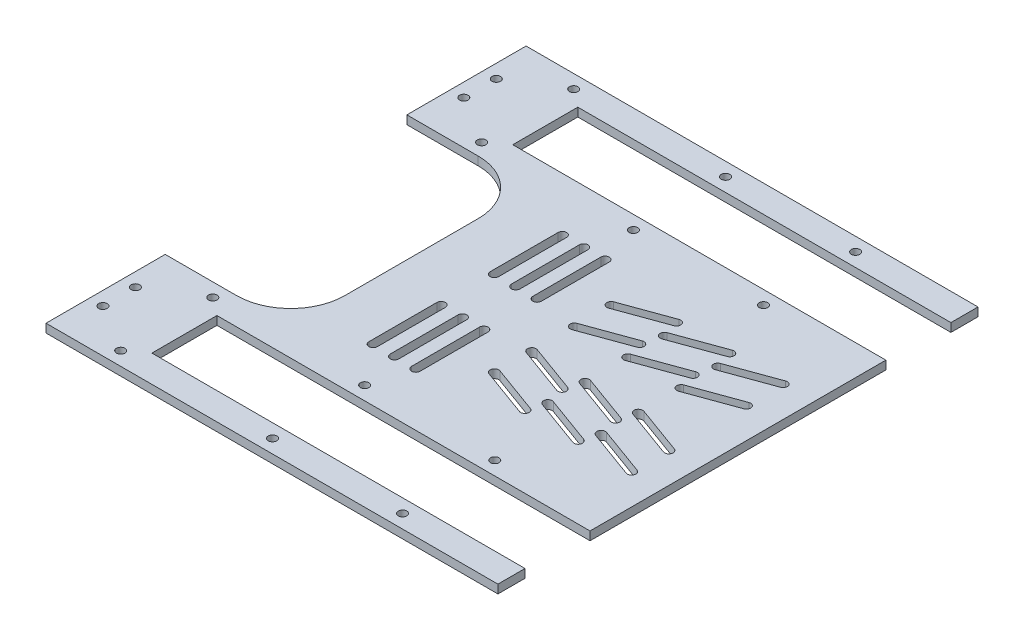
from build123d import *

# Parameters (mm, degrees)
BOSS_EXTRUDE1_DEPTH     = 2
FILLET1_R               = 12.7
CUT_EXTRUDE1_DEPTH      = 85.94357346
CUT_EXTRUDE1_DEPTH_BACK = 85.94357346
SKETCH2_R               = 1.00000054
CUT_EXTRUDE2_DEPTH      = 85.94357346
CUT_EXTRUDE2_DEPTH_BACK = 85.94357346
SKETCH3_W               = 3.81
SKETCH3_H               = 22.86
CUT_EXTRUDE3_DEPTH      = 85.94357346
CUT_EXTRUDE4_DEPTH      = 85.94357346
SKETCH7_R               = 1.00000054
SKETCH7_W               = 1.965807504
SKETCH7_H               = 35.56
CUT_EXTRUDE5_DEPTH      = 85.94357346
SKETCH9_R               = 1.00000054
SKETCH9_W               = 5.08
SKETCH9_H               = 35.56
CUT_EXTRUDE6_DEPTH      = 85.94357346
SKETCH10_W              = 3.261861975
SKETCH10_H              = 39.805650988
SKETCH10_W_2            = 3.49604191
SKETCH10_H_2            = 37.586377376
BOSS_EXTRUDE2_DEPTH     = 2
SKETCH11_W              = 18.472083706
SKETCH11_H              = 7.62
CUT_EXTRUDE7_DEPTH      = 85.349523446
CUT_EXTRUDE8_DEPTH      = 85.349523446
SKETCH13_R              = 1.00000054
BOSS_EXTRUDE3_DEPTH     = 2
CUT_EXTRUDE9_DEPTH      = 85.349523446
SKETCH15_R              = 1.00000054
BOSS_EXTRUDE6_DEPTH     = 2
SKETCH16_W              = 4.512091431
SKETCH16_H              = 18.148634424
SKETCH16_W_2            = 6.251984605
SKETCH16_H_2            = 13.072331447
BOSS_EXTRUDE7_DEPTH     = 2
SKETCH17_R              = 1.00000054
CUT_EXTRUDE10_DEPTH     = 79.736015048


with BuildPart() as part:
    # Sketch1 → Boss-Extrude1 (new body)
    with BuildSketch(Plane(origin=(0, 0, 0), x_dir=(1, 0, 0), z_dir=(0, 1, 0))):
        Polygon((-55.952019723, 28.533921393), (-55.951080052, 28.321), (-21.455288819, 28.321), (-21.455288819, -28.321), (-55.952019723, -28.321), (-55.952019723, -63.881), (55.045980277, -63.881), (55.045980277, -57.531), (32.458455221, -57.531), (-28.589936017, -57.531), (-28.589936017, -46.101), (-28.589936017, -34.671), (32.458455221, -34.671), (55.045980277, -34.671), (55.045980277, 34.671), (32.458455221, 34.671), (-28.589936017, 34.671), (-28.589936017, 46.101), (-28.589936017, 57.531), (32.458455221, 57.531), (55.045980277, 57.531), (55.045980277, 63.881), (-55.952019723, 63.881), align=None)
    extrude(amount=BOSS_EXTRUDE1_DEPTH)

    # Fillet1
    fillet1_edges = [part.edges().sort_by_distance(p)[0] for p in [
        (-21.455288819, 1, 28.321),
        (-21.455288819, 1, -28.321),
    ]]
    fillet(fillet1_edges, radius=FILLET1_R)

    # Sketch2 → Cut-Extrude1 (cut, two sides: drawn at the far end of the back side and taken through both)
    with BuildSketch(Plane(origin=(0, 2, 0), x_dir=(1, 0, 0), z_dir=(0, 1, 0)).offset(-CUT_EXTRUDE1_DEPTH_BACK)):
        with Locations(Location((51.870980277, 0, 0), (0, 0, 270))):
            Circle(SKETCH2_R)
        with Locations(Location((51.870980277, 14.1605, 0), (0, 0, 270))):
            Circle(SKETCH2_R)
        with Locations(Location((-18.280288819, 0, 0), (0, 0, 270))):
            Circle(SKETCH2_R)
        with Locations(Location((-18.280288819, -14.1605, 0), (0, 0, 270))):
            Circle(SKETCH2_R)
        with Locations(Location((-18.280288819, 14.1605, 0), (0, 0, 270))):
            Circle(SKETCH2_R)
        with Locations(Location((-36.538995414, 31.496, 0), (0, 0, 270))):
            Circle(SKETCH2_R)
        with Locations(Location((-0.948104424, 31.496, 0), (0, 0, 270))):
            Circle(SKETCH2_R)
        with Locations(Location((29.531895576, 31.488302757, 0), (0, 0, 270))):
            Circle(SKETCH2_R)
        with Locations(Location((-52.777019723, 45.1485, 0), (0, 0, 270))):
            Circle(SKETCH2_R)
        with Locations(Location((-52.777019723, 53.4035, 0), (0, 0, 270))):
            Circle(SKETCH2_R)
        with Locations(Location((-36.538995414, 60.706, 0), (0, 0, 270))):
            Circle(SKETCH2_R)
        with Locations(Location((-0.948104424, 60.706, 0), (0, 0, 270))):
            Circle(SKETCH2_R)
        with Locations(Location((29.531895576, 60.713697243, 0), (0, 0, 270))):
            Circle(SKETCH2_R)
        with Locations(Location((29.531895576, -60.713697243, 0), (0, 0, 270))):
            Circle(SKETCH2_R)
        with Locations(Location((-0.948104424, -60.706, 0), (0, 0, 270))):
            Circle(SKETCH2_R)
        with Locations(Location((-36.538995414, -60.706, 0), (0, 0, 270))):
            Circle(SKETCH2_R)
        with Locations(Location((-52.777019723, -53.4035, 0), (0, 0, 270))):
            Circle(SKETCH2_R)
        with Locations(Location((-52.777019723, -45.1485, 0), (0, 0, 270))):
            Circle(SKETCH2_R)
        with Locations(Location((29.531895576, -31.488302757, 0), (0, 0, 270))):
            Circle(SKETCH2_R)
        with Locations(Location((-0.948104424, -31.496, 0), (0, 0, 270))):
            Circle(SKETCH2_R)
        with Locations(Location((-36.538995414, -31.496, 0), (0, 0, 270))):
            Circle(SKETCH2_R)
        with Locations(Location((51.870980277, -14.1605, 0), (0, 0, 270))):
            Circle(SKETCH2_R)
    extrude(amount=CUT_EXTRUDE1_DEPTH + CUT_EXTRUDE1_DEPTH_BACK, mode=Mode.SUBTRACT)

    # Sketch3 → Cut-Extrude2 (cut, two sides: drawn at the far end of the back side and taken through both)
    with BuildSketch(Plane(origin=(0, 2, 0), x_dir=(1, 0, 0), z_dir=(0, 1, 0)).offset(-CUT_EXTRUDE2_DEPTH_BACK)):
        with Locations((-30.494936017, -46.101)):
            Rectangle(SKETCH3_W, SKETCH3_H)
        with Locations((-30.494936017, 46.101)):
            Rectangle(SKETCH3_W, SKETCH3_H)
    extrude(amount=CUT_EXTRUDE2_DEPTH + CUT_EXTRUDE2_DEPTH_BACK, mode=Mode.SUBTRACT)

    # Sketch5 → Cut-Extrude3 (cut, through all)
    with BuildSketch(Plane(origin=(0, 2, 0), x_dir=(1, 0, 0), z_dir=(0, 1, 0))):
        with BuildLine():
            Line((-7.280288819, 22.171), (-7.280288819, 6.25))
            ThreePointArc((-7.280288819, 6.25), (-8.280288819, 5.25), (-9.280288819, 6.25))
            Line((-9.280288819, 6.25), (-9.280288819, 22.171))
            ThreePointArc((-9.280288819, 22.171), (-8.280288819, 23.171), (-7.280288819, 22.171))
        make_face()
        with BuildLine():
            Line((-7.280288819, -22.171), (-7.280288819, -6.25))
            ThreePointArc((-7.280288819, -6.25), (-8.280288819, -5.25), (-9.280288819, -6.25))
            Line((-9.280288819, -6.25), (-9.280288819, -22.171))
            ThreePointArc((-9.280288819, -22.171), (-8.280288819, -23.171), (-7.280288819, -22.171))
        make_face()
        with BuildLine():
            Line((-4.280288819, 22.171), (-4.280288819, 6.25))
            ThreePointArc((-4.280288819, 6.25), (-3.280288819, 5.25), (-2.280288819, 6.25))
            Line((-2.280288819, 6.25), (-2.280288819, 22.171))
            ThreePointArc((-2.280288819, 22.171), (-3.280288819, 23.171), (-4.280288819, 22.171))
        make_face()
        with BuildLine():
            Line((2.719711181, 22.171), (2.719711181, 6.25))
            ThreePointArc((2.719711181, 6.25), (1.719711181, 5.25), (0.719711181, 6.25))
            Line((0.719711181, 6.25), (0.719711181, 22.171))
            ThreePointArc((0.719711181, 22.171), (1.719711181, 23.171), (2.719711181, 22.171))
        make_face()
        with BuildLine():
            Line((2.719711181, -22.171), (2.719711181, -6.25))
            ThreePointArc((2.719711181, -6.25), (1.719711181, -5.25), (0.719711181, -6.25))
            Line((0.719711181, -6.25), (0.719711181, -22.171))
            ThreePointArc((0.719711181, -22.171), (1.719711181, -23.171), (2.719711181, -22.171))
        make_face()
        with BuildLine():
            Line((-4.280288819, -22.171), (-4.280288819, -6.25))
            ThreePointArc((-4.280288819, -6.25), (-3.280288819, -5.25), (-2.280288819, -6.25))
            Line((-2.280288819, -6.25), (-2.280288819, -22.171))
            ThreePointArc((-2.280288819, -22.171), (-3.280288819, -23.171), (-4.280288819, -22.171))
        make_face()
    extrude(amount=-CUT_EXTRUDE3_DEPTH, mode=Mode.SUBTRACT)

    # Sketch6 → Cut-Extrude4 (cut, through all)
    with BuildSketch(Plane(origin=(0, 2, 0), x_dir=(1, 0, 0), z_dir=(0, 1, 0))):
        with BuildLine():
            Line((23.282365986, 8.144284406), (12.061731324, 4.060307379))
            ThreePointArc((12.061731324, 4.060307379), (10.78001856, 4.657979857), (11.377691038, 5.939692621))
            Line((11.377691038, 5.939692621), (22.598325699, 10.023669647))
            ThreePointArc((22.598325699, 10.023669647), (23.880038464, 9.42599717), (23.282365986, 8.144284406))
        make_face()
        with BuildLine():
            Line((35.782365986, 8.144284406), (24.561731324, 4.060307379))
            ThreePointArc((24.561731324, 4.060307379), (23.28001856, 4.657979857), (23.877691038, 5.939692621))
            Line((23.877691038, 5.939692621), (35.098325699, 10.023669647))
            ThreePointArc((35.098325699, 10.023669647), (36.380038464, 9.42599717), (35.782365986, 8.144284406))
        make_face()
        with BuildLine():
            Line((48.282365986, 8.144284406), (37.061731324, 4.060307379))
            ThreePointArc((37.061731324, 4.060307379), (35.78001856, 4.657979857), (36.377691038, 5.939692621))
            Line((36.377691038, 5.939692621), (47.598325699, 10.023669647))
            ThreePointArc((47.598325699, 10.023669647), (48.880038464, 9.42599717), (48.282365986, 8.144284406))
        make_face()
        with BuildLine():
            Line((23.212938712, 16.811828882), (11.992304051, 12.727851856))
            ThreePointArc((11.992304051, 12.727851856), (10.710591286, 13.325524333), (11.308263764, 14.607237098))
            Line((11.308263764, 14.607237098), (22.528898426, 18.691214124))
            ThreePointArc((22.528898426, 18.691214124), (23.81061119, 18.093541647), (23.212938712, 16.811828882))
        make_face()
        with BuildLine():
            Line((35.712938712, 16.811828882), (24.492304051, 12.727851856))
            ThreePointArc((24.492304051, 12.727851856), (23.210591286, 13.325524333), (23.808263764, 14.607237098))
            Line((23.808263764, 14.607237098), (35.028898426, 18.691214124))
            ThreePointArc((35.028898426, 18.691214124), (36.31061119, 18.093541647), (35.712938712, 16.811828882))
        make_face()
        with BuildLine():
            Line((48.212938712, 16.811828882), (36.992304051, 12.727851856))
            ThreePointArc((36.992304051, 12.727851856), (35.710591286, 13.325524333), (36.308263764, 14.607237098))
            Line((36.308263764, 14.607237098), (47.528898426, 18.691214124))
            ThreePointArc((47.528898426, 18.691214124), (48.81061119, 18.093541647), (48.212938712, 16.811828882))
        make_face()
        with BuildLine():
            Line((48.282365986, -8.144284406), (37.061731324, -4.060307379))
            ThreePointArc((37.061731324, -4.060307379), (35.78001856, -4.657979857), (36.377691038, -5.939692621))
            Line((36.377691038, -5.939692621), (47.598325699, -10.023669647))
            ThreePointArc((47.598325699, -10.023669647), (48.880038464, -9.42599717), (48.282365986, -8.144284406))
        make_face()
        with BuildLine():
            Line((35.782365986, -8.144284406), (24.561731324, -4.060307379))
            ThreePointArc((24.561731324, -4.060307379), (23.28001856, -4.657979857), (23.877691038, -5.939692621))
            Line((23.877691038, -5.939692621), (35.098325699, -10.023669647))
            ThreePointArc((35.098325699, -10.023669647), (36.380038464, -9.42599717), (35.782365986, -8.144284406))
        make_face()
        with BuildLine():
            Line((23.282365986, -8.144284406), (12.061731324, -4.060307379))
            ThreePointArc((12.061731324, -4.060307379), (10.78001856, -4.657979857), (11.377691038, -5.939692621))
            Line((11.377691038, -5.939692621), (22.598325699, -10.023669647))
            ThreePointArc((22.598325699, -10.023669647), (23.880038464, -9.42599717), (23.282365986, -8.144284406))
        make_face()
        with BuildLine():
            Line((48.212938712, -16.811828882), (36.992304051, -12.727851856))
            ThreePointArc((36.992304051, -12.727851856), (35.710591286, -13.325524333), (36.308263764, -14.607237098))
            Line((36.308263764, -14.607237098), (47.528898426, -18.691214124))
            ThreePointArc((47.528898426, -18.691214124), (48.81061119, -18.093541647), (48.212938712, -16.811828882))
        make_face()
        with BuildLine():
            Line((35.712938712, -16.811828882), (24.492304051, -12.727851856))
            ThreePointArc((24.492304051, -12.727851856), (23.210591286, -13.325524333), (23.808263764, -14.607237098))
            Line((23.808263764, -14.607237098), (35.028898426, -18.691214124))
            ThreePointArc((35.028898426, -18.691214124), (36.31061119, -18.093541647), (35.712938712, -16.811828882))
        make_face()
        with BuildLine():
            Line((23.212938712, -16.811828882), (11.992304051, -12.727851856))
            ThreePointArc((11.992304051, -12.727851856), (10.710591286, -13.325524333), (11.308263764, -14.607237098))
            Line((11.308263764, -14.607237098), (22.528898426, -18.691214124))
            ThreePointArc((22.528898426, -18.691214124), (23.81061119, -18.093541647), (23.212938712, -16.811828882))
        make_face()
    extrude(amount=-CUT_EXTRUDE4_DEPTH, mode=Mode.SUBTRACT)

    # Sketch7 → Cut-Extrude5 (cut, through all)
    with BuildSketch(Plane.XZ):
        with Locations((-54.742827227, 53.4035)):
            Circle(SKETCH7_R)
        with Locations((-54.742827227, 45.1485)):
            Circle(SKETCH7_R)
        with Locations((-54.742827227, -45.1485)):
            Circle(SKETCH7_R)
        with Locations((-54.742827227, -53.4035)):
            Circle(SKETCH7_R)
        with Locations((-56.934923475, 46.101)):
            Rectangle(SKETCH7_W, SKETCH7_H)
        with Locations((-56.934923475, -46.101)):
            Rectangle(SKETCH7_W, SKETCH7_H)
    extrude(amount=-CUT_EXTRUDE5_DEPTH, mode=Mode.SUBTRACT)

    # Sketch9 → Cut-Extrude6 (cut, through all)
    with BuildSketch(Plane.XZ):
        with Locations(Location((-47.697019723, 53.4035, 0), (0, 0, 270))):
            Circle(SKETCH9_R)
        with Locations(Location((-47.697019723, 45.1485, 0), (0, 0, 270))):
            Circle(SKETCH9_R)
        with Locations(Location((-47.697019723, -45.1485, 0), (0, 0, 90))):
            Circle(SKETCH9_R)
        with Locations(Location((-47.697019723, -53.4035, 0), (0, 0, 90))):
            Circle(SKETCH9_R)
        with Locations((-53.412019723, 46.101)):
            Rectangle(SKETCH9_W, SKETCH9_H)
        with Locations((-53.412019723, -46.101)):
            Rectangle(SKETCH9_W, SKETCH9_H)
    extrude(amount=-CUT_EXTRUDE6_DEPTH, mode=Mode.SUBTRACT)

    # Sketch10 → Boss-Extrude2 (add)
    with BuildSketch(Plane(origin=(0, 2, 0), x_dir=(1, 0, 0), z_dir=(0, 1, 0))):
        with Locations((-18.280288819, 0)):
            Rectangle(SKETCH10_W, SKETCH10_H)
        with Locations((51.870980277, 0)):
            Rectangle(SKETCH10_W_2, SKETCH10_H_2)
    extrude(amount=-BOSS_EXTRUDE2_DEPTH)

    # Sketch11 → Cut-Extrude7 (cut, through all)
    with BuildSketch(Plane(origin=(0, 2, 0), x_dir=(1, 0, 0), z_dir=(0, 1, 0))):
        with Locations((-41.63597787, -38.481)):
            Rectangle(SKETCH11_W, SKETCH11_H)
    extrude(amount=-CUT_EXTRUDE7_DEPTH, mode=Mode.SUBTRACT)


with BuildPart() as cut_extrude7_piece_1:
    # of the separate pieces the step leaves, piece 1, a body of its own (cut_extrude7_pieces)
    add(part.part.solids().sort_by_distance((-50.872019723, 2, -28.321))[0])

    # Sketch12 → Cut-Extrude8 (cut, through all)
    with BuildSketch(Plane(origin=(0, 2, 0), x_dir=(1, 0, 0), z_dir=(0, 1, 0))):
        Polygon((-32.399936017, 34.671), (-69.840957795, 34.671), (-69.840957795, 70.713964433), (61.672853026, 70.713964433), (61.672853026, 34.671), align=None)
    extrude(amount=-CUT_EXTRUDE8_DEPTH, mode=Mode.SUBTRACT)

    # Sketch13 → Boss-Extrude3 (add)
    with BuildSketch(Plane(origin=(0, 2, 0), x_dir=(1, 0, 0), z_dir=(0, 1, 0))):
        Polygon((55.045980277, 49.911), (-32.399936017, 49.911), (-32.399936017, 34.671), (-50.872019723, 34.671), (-50.872019723, 56.261), (55.045980277, 56.261), align=None)
        with Locations(Location((29.531895576, 53.093697243, 0), (0, 0, 270))):
            Circle(SKETCH13_R, mode=Mode.SUBTRACT)
        with Locations(Location((-0.948104424, 53.086, 0), (0, 0, 270))):
            Circle(SKETCH13_R, mode=Mode.SUBTRACT)
        with Locations(Location((-36.538995414, 53.086, 0), (0, 0, 270))):
            Circle(SKETCH13_R, mode=Mode.SUBTRACT)
        with Locations(Location((-47.697019723, 45.7835, 0), (0, 0, 270))):
            Circle(SKETCH13_R, mode=Mode.SUBTRACT)
        with Locations(Location((-47.697019723, 37.5285, 0), (0, 0, 270))):
            Circle(SKETCH13_R, mode=Mode.SUBTRACT)
    extrude(amount=-BOSS_EXTRUDE3_DEPTH)

    # Sketch15 → Boss-Extrude6 (add)
    with BuildSketch(Plane(origin=(0, 2, 0), x_dir=(1, 0, 0), z_dir=(0, 1, 0))):
        Polygon((-50.872019723, -34.671), (-50.872019723, -56.261), (55.045980277, -56.261), (55.045980277, -49.911), (-32.399936017, -49.911), (-32.399936017, -34.671), align=None)
        with Locations(Location((-47.697019723, -45.7835, 0), (0, 0, 270))):
            Circle(SKETCH15_R, mode=Mode.SUBTRACT)
        with Locations(Location((-47.697019723, -37.5285, 0), (0, 0, 270))):
            Circle(SKETCH15_R, mode=Mode.SUBTRACT)
        with Locations(Location((-36.538995414, -53.086, 0), (0, 0, 270))):
            Circle(SKETCH15_R, mode=Mode.SUBTRACT)
        with Locations(Location((-0.948104424, -53.086, 0), (0, 0, 270))):
            Circle(SKETCH15_R, mode=Mode.SUBTRACT)
        with Locations(Location((29.531895576, -53.093697243, 0), (0, 0, 270))):
            Circle(SKETCH15_R, mode=Mode.SUBTRACT)
    extrude(amount=-BOSS_EXTRUDE6_DEPTH)

    # Sketch16 → Boss-Extrude7 (add)
    with BuildSketch(Plane.XZ):
        with Locations((-48.131896009, -42.111008016)):
            Rectangle(SKETCH16_W, SKETCH16_H)
        with Locations((-47.11527877, 41.979427187)):
            Rectangle(SKETCH16_W_2, SKETCH16_H_2)
    extrude(amount=-BOSS_EXTRUDE7_DEPTH)

    # Sketch17 → Cut-Extrude10 (cut, through all)
    with BuildSketch(Plane(origin=(0, 2, 0), x_dir=(1, 0, 0), z_dir=(0, 1, 0))):
        with Locations(Location((-47.697019723, -38.481, 0), (0, 0, 270))):
            Circle(SKETCH17_R)
        with Locations(Location((-47.697019723, -46.101, 0), (0, 0, 90))):
            Circle(SKETCH17_R)
        with Locations(Location((-47.697019723, 38.481, 0), (0, 0, 90))):
            Circle(SKETCH17_R)
        with Locations(Location((-47.697019723, 46.101, 0), (0, 0, 270))):
            Circle(SKETCH17_R)
    extrude(amount=-CUT_EXTRUDE10_DEPTH, mode=Mode.SUBTRACT)


with BuildPart() as cut_extrude7_piece_2:
    # of the separate pieces the step leaves, piece 2, a body of its own (cut_extrude7_pieces)
    add(part.part.solids().sort_by_distance((-32.399936017, 2, 42.291))[0])

    # Sketch14 → Cut-Extrude9 (cut, through all)
    with BuildSketch(Plane(origin=(0, 2, 0), x_dir=(1, 0, 0), z_dir=(0, 1, 0))):
        Polygon((-32.399936017, -42.291), (-50.872019723, -42.291), (-50.872019723, -63.881), (55.045980277, -63.881), (55.045980277, -57.531), (-32.399936017, -57.531), align=None)
    extrude(amount=-CUT_EXTRUDE9_DEPTH, mode=Mode.SUBTRACT)


solid = cut_extrude7_piece_1.part
